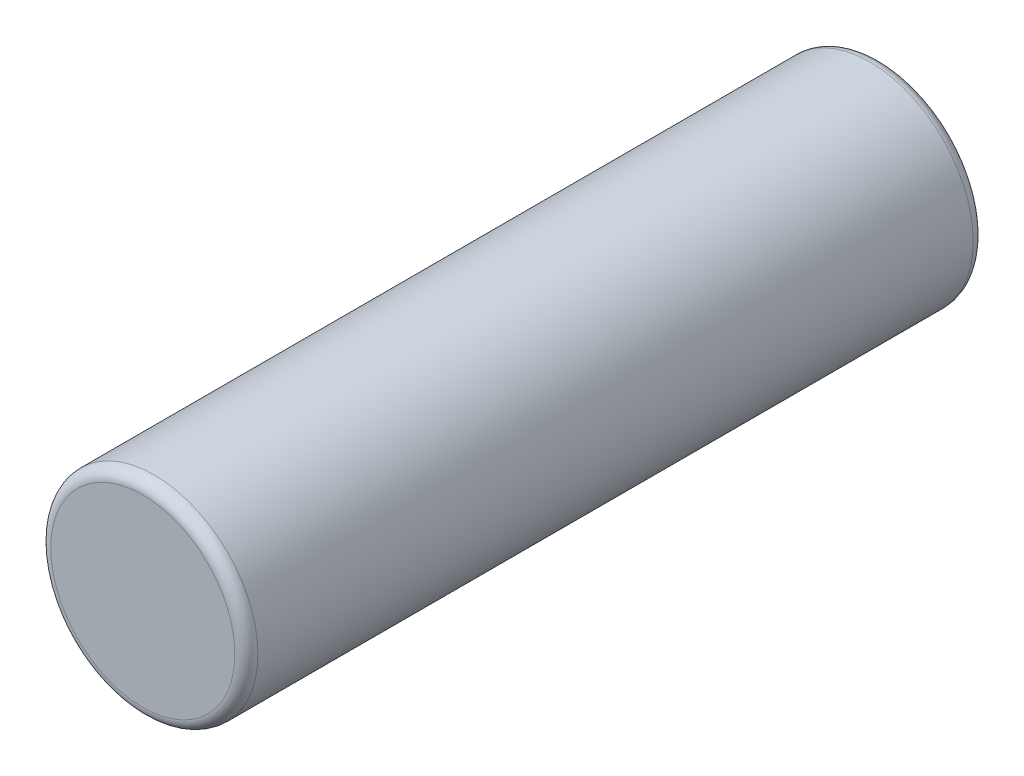
from build123d import *


with BuildPart() as part:
    # Sketch1 → Revolve1 (revolve)
    with BuildSketch(Plane.XZ.offset(1.208791209), mode=Mode.PRIVATE) as revolve1_sk:
        with BuildLine():
            Line((6.131868132, 64.15), (-1.868131868, 64.15))
            Line((-1.868131868, 64.15), (-1.868131868, 0))
            Line((-1.868131868, 0), (2.131868132, 0))
            ThreePointArc((2.131868132, 0), (2.485421522, 0.146446609), (2.631868132, 0.5))
            Line((2.631868132, 0.5), (2.631868132, 2))
            ThreePointArc((2.631868132, 2), (2.778314741, 2.353553391), (3.131868132, 2.5))
            Line((3.131868132, 2.5), (4.631868132, 2.5))
            Line((4.631868132, 2.5), (4.631868132, 1.936491673))
            ThreePointArc((4.631868132, 1.936491673), (5.050729302, 0.711746802), (6.131868132, 0))
            ThreePointArc((6.131868132, 0), (6.838974913, 0.292893219), (7.131868132, 1))
            Line((7.131868132, 1), (7.131868132, 63.15))
            ThreePointArc((7.131868132, 63.15), (6.838974913, 63.857106781), (6.131868132, 64.15))
        make_face()
    revolve(revolve1_sk.sketch.rotate(Axis((-1.868131868, -1.208791209, 64.151253994), (0, 0, -1)), 180), axis=Axis((-1.868131868, -1.208791209, 64.151253994), (0, 0, -1)))


solid = part.part
